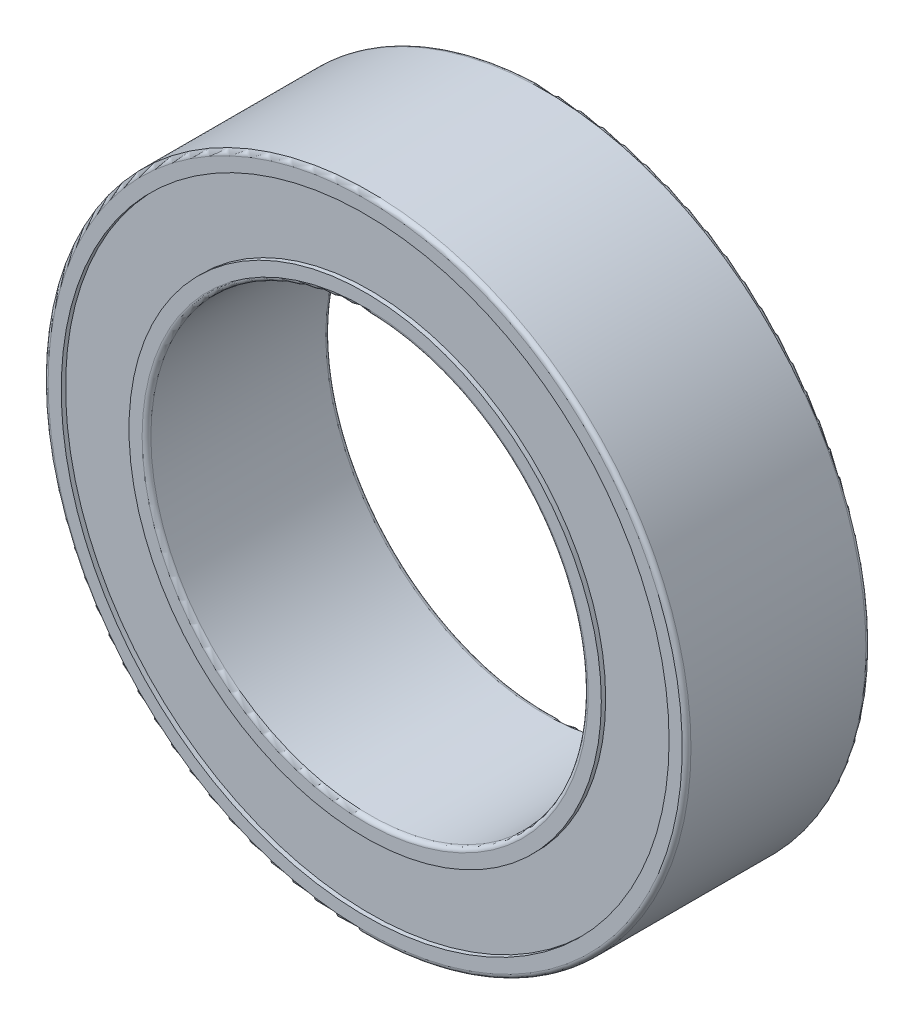
from build123d import *

# Parameters (mm, degrees)
FILLET1_R = 0.1


with BuildPart() as part:
    # Sketch1 → Revolve1 (revolve)
    with BuildSketch(Plane(origin=(0, 0, 0), x_dir=(0, 0, -1), z_dir=(1, 0, 0)), mode=Mode.PRIVATE) as revolve1_sk:
        Polygon((-2.1, 5), (-2.1, 5.4), (-2, 5.4), (-2, 6.95), (-2.1, 6.95), (-2.1, 7.35), (2.1, 7.35), (2.1, 6.95), (2, 6.95), (2, 5.4), (2.1, 5.4), (2.1, 5), align=None)
    revolve(revolve1_sk.sketch.rotate(Axis((0, 0, 14.88), (0, 0, -1)), 90), axis=Axis((0, 0, 14.88), (0, 0, -1)))

    # Fillet1
    fillet1_edges = [part.edges().sort_by_distance(p)[0] for p in [
        (-7.35, 0, 2.1),
        (-7.35, 0, -2.1),
        (-5, 0, -2.1),
        (-5, 0, 2.1),
    ]]
    fillet(fillet1_edges, radius=FILLET1_R)


solid = part.part
